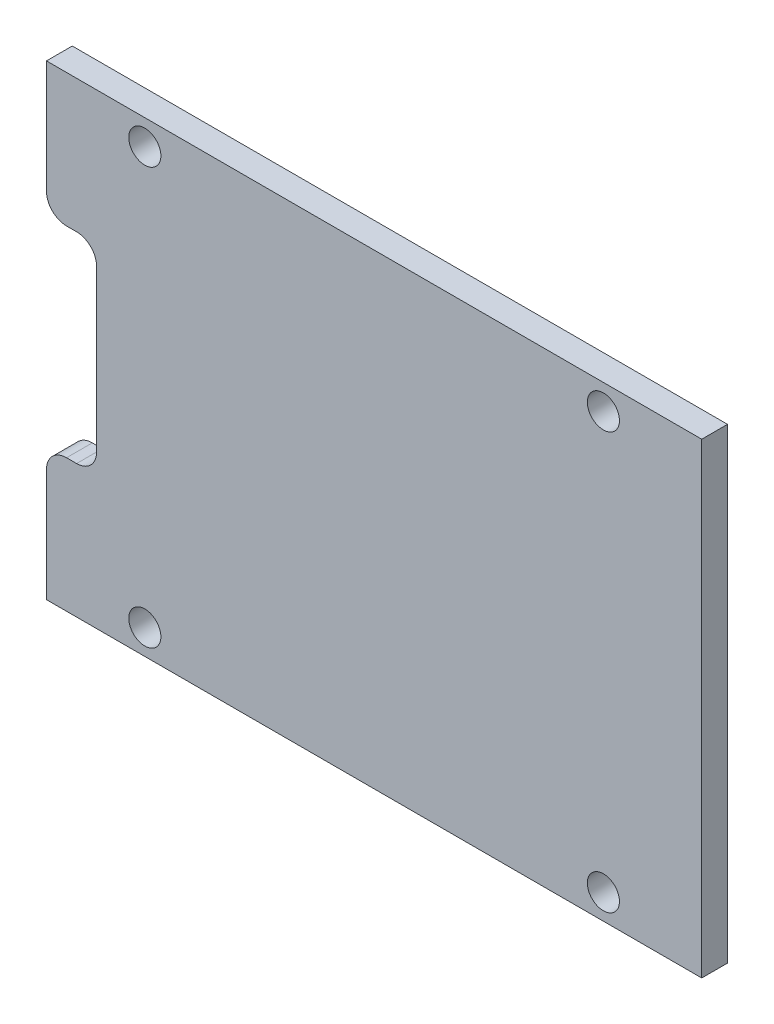
from build123d import *

# Parameters (mm, degrees)
SKETCH1_W           = 65.3
SKETCH1_H           = 46.5
BOSS_EXTRUDE1_DEPTH = 2.57
SKETCH2_R           = 1.6
CUT_EXTRUDE2_DEPTH  = 2.57
SKETCH3_R           = 5
CUT_EXTRUDE3_DEPTH  = 2.57
SKETCH4_W           = 5
SKETCH4_H           = 20
CUT_EXTRUDE4_DEPTH  = 10
FILLET1_R           = 2


with BuildPart() as part:
    # Sketch1 → Boss-Extrude1 (new body)
    with BuildSketch(Plane.XY):
        with Locations((-7.15, -18.05)):
            Rectangle(SKETCH1_W, SKETCH1_H)
    extrude(amount=BOSS_EXTRUDE1_DEPTH)

    # Sketch2 → Cut-Extrude2 (cut)
    with BuildSketch(Plane.XY.offset(2.57)):
        with Locations((15.7, -38.8)):
            Circle(SKETCH2_R)
        with Locations((15.7, 2.7)):
            Circle(SKETCH2_R)
        with Locations((-30, 2.7)):
            Circle(SKETCH2_R)
        with Locations((-30, -38.8)):
            Circle(SKETCH2_R)
    extrude(amount=-CUT_EXTRUDE2_DEPTH, mode=Mode.SUBTRACT)

    # Sketch3 → Cut-Extrude3 (cut)
    with BuildSketch(Plane.XY.offset(2.57)):
        with Locations((-39.8, -18.05)):
            Circle(SKETCH3_R)
    extrude(amount=-CUT_EXTRUDE3_DEPTH, mode=Mode.SUBTRACT)

    # Sketch4 → Cut-Extrude4 (cut)
    with BuildSketch(Plane.XY.offset(2.57)):
        with Locations((-37.3, -18.05)):
            Rectangle(SKETCH4_W, SKETCH4_H)
    extrude(amount=-CUT_EXTRUDE4_DEPTH, mode=Mode.SUBTRACT)

    # Fillet1
    fillet1_edges = [part.edges().sort_by_distance(p)[0] for p in [
        (-39.8, -8.05, 1.285),
        (-34.8, -28.05, 1.285),
        (-39.8, -28.05, 1.285),
        (-34.8, -8.05, 1.285),
    ]]
    fillet(fillet1_edges, radius=FILLET1_R)


solid = part.part
